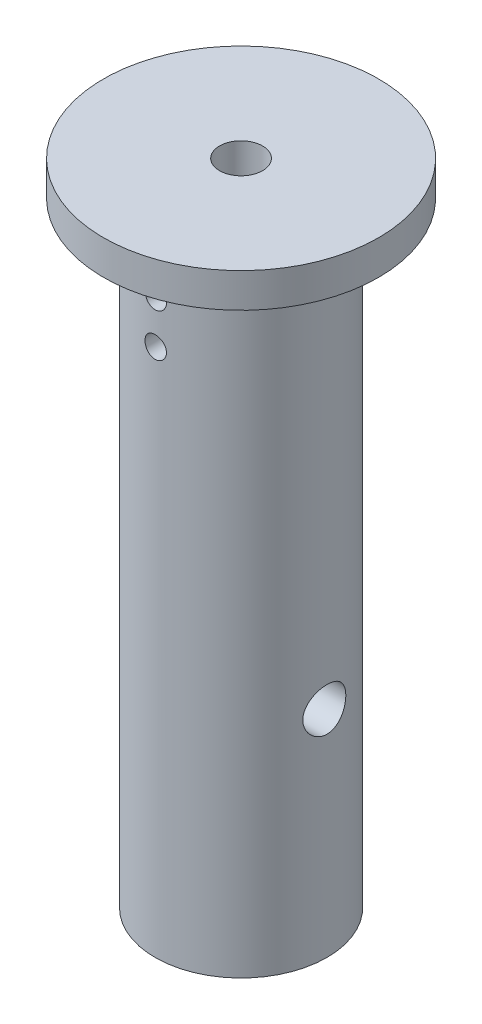
from build123d import *

# Parameters (mm, degrees)
M3_TAPPED_HOLE2_D          = 2.5
M3_TAPPED_HOLE2_DEPTH      = 7.5
M3_TAPPED_HOLE2_TIP        = 0.751075774
SKETCH4_W                  = 6
SKETCH4_H                  = 16
CUT_EXTRUDE1_DEPTH         = 3.5
SKETCH6_W                  = 1.25
SKETCH6_H                  = 16
M3_TAPPED_HOLE1_AT_2_COUNT = 2
M3_TAPPED_HOLE1_AT_2_PITCH = 5
CUT_EXTRUDE2_DEPTH         = 51.815844075
CUT_EXTRUDE2_DEPTH_BACK    = 51.815844075
SKETCH8_R                  = 2.5


with BuildPart() as part:
    # Sketch1 → Revolve1 (revolve)
    with BuildSketch(Plane.XY):
        Polygon((2.5, 30), (2.5, 0), (0, 0), (0, -45.5), (10, -45.5), (10, 26), (16, 26), (16, 30), align=None)
    revolve(axis=Axis((0, -45.5, 0), (0, 1, 0)))

    # M3 Tapped Hole2
    with Locations(Plane(origin=(0, -45.5, 0), x_dir=(-1, 0, 0), z_dir=(0, -1, 0))):
        with Locations((-3.535533906, 3.535533906), (-3.535533906, -3.535533906), (3.535533906, -3.535533906), (3.535533906, 3.535533906)):
            Hole(M3_TAPPED_HOLE2_D / 2, depth=M3_TAPPED_HOLE2_DEPTH)
            with Locations((0, 0, -(M3_TAPPED_HOLE2_DEPTH + M3_TAPPED_HOLE2_TIP / 2))):  # 118° drill point
                Cone(0, M3_TAPPED_HOLE2_D / 2, M3_TAPPED_HOLE2_TIP, mode=Mode.SUBTRACT)

    # Sketch4 → Cut-Extrude1 (cut)
    with BuildSketch(Plane.ZY.offset(10)):
        with Locations((0, 2.5)):
            Rectangle(SKETCH4_W, SKETCH4_H)
        with BuildLine():
            ThreePointArc((-3, 10.5), (0, 13.5), (3, 10.5))
            Line((3, 10.5), (-3, 10.5))
        make_face()
        with BuildLine():
            Line((-3, -5.5), (3, -5.5))
            ThreePointArc((3, -5.5), (0, -8.5), (-3, -5.5))
        make_face()
    extrude(amount=-CUT_EXTRUDE1_DEPTH, mode=Mode.SUBTRACT)

    # Sketch6 → M3 Tapped Hole1 (revolve, cut)
    with BuildSketch(Plane(origin=(0, 21, 0), x_dir=(0, 1, 0), z_dir=(1, 0, 0))):
        with Locations((0.625, 8)):
            Rectangle(SKETCH6_W, SKETCH6_H)
    m3_tapped_hole1 = revolve(axis=Axis((0, 21, -6.35), (0, 0, 1)), mode=Mode.SUBTRACT)

    # M3 Tapped Hole1 at 2: M3 Tapped Hole1 ×2
    with Locations(*[(0, -i * M3_TAPPED_HOLE1_AT_2_PITCH, 0) for i in range(1, M3_TAPPED_HOLE1_AT_2_COUNT)]):
        add(m3_tapped_hole1, mode=Mode.SUBTRACT)

    # Sketch8 → Cut-Extrude2 (cut, two sides: drawn at the far end of the back side and taken through both)
    with BuildSketch(Plane(origin=(0, 0, 0), x_dir=(0, 0, -1), z_dir=(1, 0, 0)).offset(-CUT_EXTRUDE2_DEPTH_BACK)):
        with Locations((0, -20.5)):
            Circle(SKETCH8_R)
    extrude(amount=CUT_EXTRUDE2_DEPTH + CUT_EXTRUDE2_DEPTH_BACK, mode=Mode.SUBTRACT)


solid = part.part
